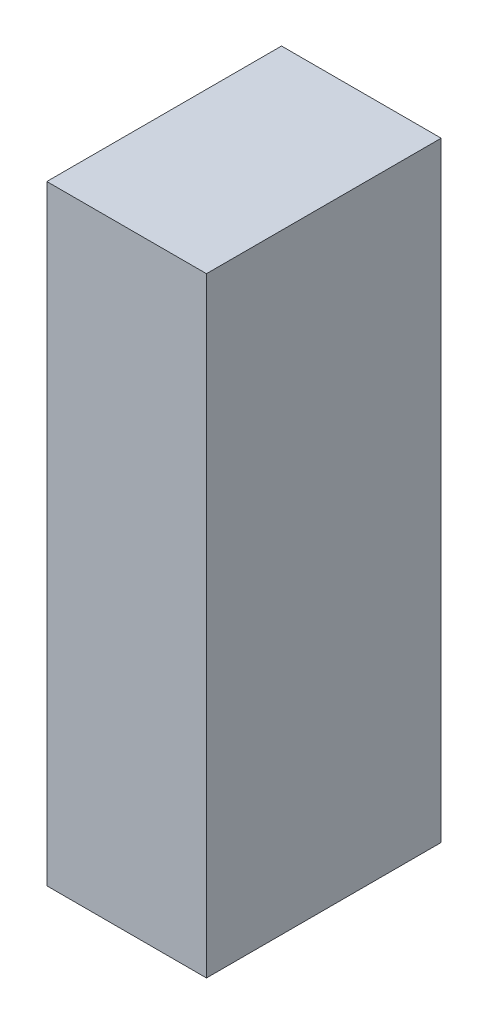
from build123d import *

# Parameters (mm, degrees)
SKETCH2_W           = 11.7
SKETCH2_H           = 17.2
BOSS_EXTRUDE1_DEPTH = 44.7


with BuildPart() as part:
    # Sketch2 → Boss-Extrude1 (new body)
    with BuildSketch(Plane(origin=(0, 0, 0), x_dir=(1, 0, 0), z_dir=(0, 1, 0))):
        with Locations((5.85, 8.6)):
            Rectangle(SKETCH2_W, SKETCH2_H)
    extrude(amount=BOSS_EXTRUDE1_DEPTH)


solid = part.part
